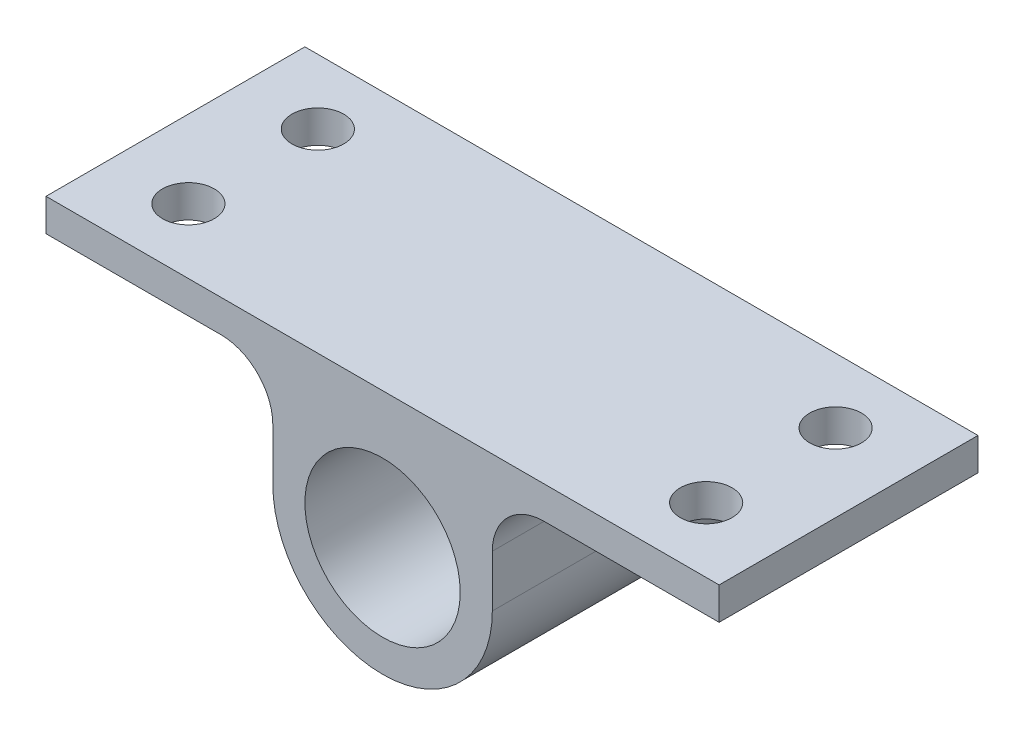
from build123d import *

# Parameters (mm, degrees)
SKETCH1_R           = 19.05
BOSS_EXTRUDE1_DEPTH = 31.75
SKETCH3_R           = 6.35
CUT_EXTRUDE1_DEPTH  = 127.593613969


with BuildPart() as part:
    # Sketch1 → Boss-Extrude1 (new, symmetric)
    with BuildSketch(Plane.XY):
        with BuildLine():
            Line((-51.074053478, -18.968891898), (-51.074053478, -6.268891898))
            ThreePointArc((-51.074053478, -6.268891898), (-54.793797356, 2.711364223), (-63.774053478, 6.431108102))
            Line((-63.774053478, 6.431108102), (-106.700053478, 6.431108102))
            Line((-106.700053478, 6.431108102), (-106.700053478, 14.381308102))
            Line((-106.700053478, 14.381308102), (58.399946522, 14.381308102))
            Line((58.399946522, 14.381308102), (58.399946522, 6.431108102))
            Line((58.399946522, 6.431108102), (15.473946522, 6.431108102))
            ThreePointArc((15.473946522, 6.431108102), (6.493690401, 2.711364223), (2.773946522, -6.268891898))
            Line((2.773946522, -6.268891898), (2.773946522, -18.968891898))
            ThreePointArc((2.773946522, -18.968891898), (-24.150053478, -45.892891898), (-51.074053478, -18.968891898))
        make_face()
        with Locations((-24.150053478, -18.968891898)):
            Circle(SKETCH1_R, mode=Mode.SUBTRACT)
    extrude(amount=BOSS_EXTRUDE1_DEPTH, both=True)

    # Sketch3 → Cut-Extrude1 (cut, through all)
    with BuildSketch(Plane(origin=(0, 14.381308102, 0), x_dir=(1, 0, 0), z_dir=(0, 1, 0))):
        with Locations(Location((-87.650053478, 15.875, 0), (0, 0, 270))):
            Circle(SKETCH3_R)
        with Locations(Location((-87.650053478, -15.875, 0), (0, 0, 270))):
            Circle(SKETCH3_R)
        with Locations(Location((39.349946522, -15.875, 0), (0, 0, 270))):
            Circle(SKETCH3_R)
        with Locations(Location((39.349946522, 15.875, 0), (0, 0, 270))):
            Circle(SKETCH3_R)
    extrude(amount=-CUT_EXTRUDE1_DEPTH, mode=Mode.SUBTRACT)


solid = part.part
